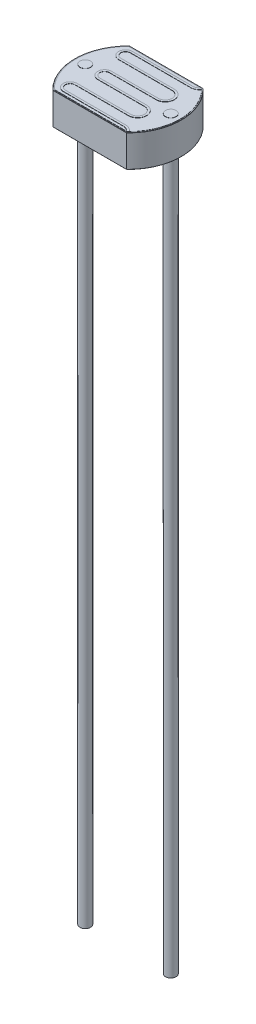
from build123d import *
from build123d.topology import SkipClean

# Parameters (mm, degrees)
BOSS_EXTRUDE1_DEPTH      = 1.5
BOSS_EXTRUDE2_DEPTH      = 0.01
BOSS_EXTRUDE3_DEPTH      = 0.01
BOSS_EXTRUDE4_DEPTH      = 0.01
BOSS_EXTRUDE4_DEPTH_BACK = 35
SKETCH4_R                = 0.25
FILLET1_R                = 0.01


with BuildPart() as part:
    # Sketch1 → Boss-Extrude1 (new body)
    with BuildSketch(Plane(origin=(0, 0, 0), x_dir=(1, 0, 0), z_dir=(0, 1, 0))):
        with BuildLine():
            Line((-1.734935157, 1.8), (1.734935157, 1.8))
            ThreePointArc((1.734935157, 1.8), (2.5, 0), (1.734935157, -1.8))
            Line((1.734935157, -1.8), (-1.734935157, -1.8))
            ThreePointArc((-1.734935157, -1.8), (-2.5, 0), (-1.734935157, 1.8))
        make_face()
    extrude(amount=BOSS_EXTRUDE1_DEPTH)

    # Sketch2 → Boss-Extrude2 (add)
    with BuildSketch(Plane(origin=(0, 1.5, 0), x_dir=(1, 0, 0), z_dir=(0, 1, 0))):
        with BuildLine():
            Line((-1.71464282, -1.75), (1.71464282, -1.75))
            ThreePointArc((1.71464282, -1.75), (2.45, 0), (1.71464282, 1.75))
            Line((1.71464282, 1.75), (-1.71464282, 1.75))
            ThreePointArc((-1.71464282, 1.75), (-2.45, 0), (-1.71464282, -1.75))
        make_face()
    extrude(amount=BOSS_EXTRUDE2_DEPTH)

    # Sketch3 → Boss-Extrude3 (add)
    with SkipClean():  # the faces are left unmerged after this step: merging them gives an invalid solid
        with BuildSketch(Plane(origin=(0, 1.51, 0), x_dir=(1, 0, 0), z_dir=(0, 1, 0))):
            with BuildLine():
                Line((-1.100223992, 0.325), (1.100223992, 0.325))
                ThreePointArc((1.100223992, 0.325), (1.425223992, 0.65), (1.100223992, 0.975))
                Line((1.100223992, 0.975), (-1.100223992, 0.975))
                Line((-1.100223992, 0.975), (-1.415621536, 0.975))
                ThreePointArc((-1.415621536, 0.975), (-1.740621536, 1.3), (-1.415621536, 1.625))
                Line((-1.415621536, 1.625), (1.100223992, 1.625))
                Line((1.100223992, 1.625), (1.414873992, 1.625))
                ThreePointArc((1.414873992, 1.625), (1.55739592, 1.657916964), (1.671047761, 1.75))
                Line((1.671047761, 1.75), (1.71464282, 1.75))
                ThreePointArc((1.71464282, 1.75), (1.737970537, 1.726834796), (1.760985316, 1.703358658))
                ThreePointArc((1.760985316, 1.703358658), (1.609556335, 1.572211984), (1.414873992, 1.525))
                Line((1.414873992, 1.525), (1.100223992, 1.525))
                Line((1.100223992, 1.525), (-1.415621536, 1.525))
                ThreePointArc((-1.415621536, 1.525), (-1.640621536, 1.3), (-1.415621536, 1.075))
                Line((-1.415621536, 1.075), (-1.100223992, 1.075))
                Line((-1.100223992, 1.075), (1.100223992, 1.075))
                ThreePointArc((1.100223992, 1.075), (1.525223992, 0.65), (1.100223992, 0.225))
                Line((1.100223992, 0.225), (-1.100223992, 0.225))
                ThreePointArc((-1.100223992, 0.225), (-1.325223992, 0), (-1.100223992, -0.225))
                Line((-1.100223992, -0.225), (1.100223992, -0.225))
                ThreePointArc((1.100223992, -0.225), (1.525223992, -0.65), (1.100223992, -1.075))
                Line((1.100223992, -1.075), (-1.100223992, -1.075))
                Line((-1.100223992, -1.075), (-1.415621536, -1.075))
                ThreePointArc((-1.415621536, -1.075), (-1.640621536, -1.3), (-1.415621536, -1.525))
                Line((-1.415621536, -1.525), (1.100223992, -1.525))
                Line((1.100223992, -1.525), (1.414873992, -1.525))
                ThreePointArc((1.414873992, -1.525), (1.609556335, -1.572211984), (1.760985316, -1.703358658))
                ThreePointArc((1.760985316, -1.703358658), (1.737970537, -1.726834796), (1.71464282, -1.75))
                Line((1.71464282, -1.75), (1.671047761, -1.75))
                ThreePointArc((1.671047761, -1.75), (1.55739592, -1.657916964), (1.414873992, -1.625))
                Line((1.414873992, -1.625), (1.100223992, -1.625))
                Line((1.100223992, -1.625), (-1.415621536, -1.625))
                ThreePointArc((-1.415621536, -1.625), (-1.740621536, -1.3), (-1.415621536, -0.975))
                Line((-1.415621536, -0.975), (-1.100223992, -0.975))
                Line((-1.100223992, -0.975), (1.100223992, -0.975))
                ThreePointArc((1.100223992, -0.975), (1.425223992, -0.65), (1.100223992, -0.325))
                Line((1.100223992, -0.325), (-1.100223992, -0.325))
                ThreePointArc((-1.100223992, -0.325), (-1.425223992, 0), (-1.100223992, 0.325))
            make_face()
        extrude(amount=BOSS_EXTRUDE3_DEPTH)

    # Sketch4 → Boss-Extrude4 (add, two sides: drawn at the far end of the back side and taken through both)
    with SkipClean():  # the faces are left unmerged after this step: merging them gives an invalid solid
        with BuildSketch(Plane(origin=(0, 1.51, 0), x_dir=(1, 0, 0), z_dir=(0, 1, 0)).offset(-BOSS_EXTRUDE4_DEPTH_BACK)):
            with Locations((-2.009742492, 0)):
                Circle(SKETCH4_R)
            with Locations((2.009742492, 0)):
                Circle(SKETCH4_R)
        extrude(amount=BOSS_EXTRUDE4_DEPTH + BOSS_EXTRUDE4_DEPTH_BACK)

    # Fillet1
    fillet1_edges = [part.edges().sort_by_distance(p)[0] for p in [
        (1.734935157, 0.75, -1.8),
        (0, 1.5, -1.8),
        (0, 0, -1.8),
        (2.5, 0, 0),
        (2.5, 1.5, 0),
        (1.734935157, 0.75, 1.8),
        (0, 0, 1.8),
        (0, 1.5, 1.8),
        (-1.734935157, 0.75, 1.8),
        (-2.5, 0, 0),
        (-2.5, 1.5, 0),
    ]]
    fillet(fillet1_edges, radius=FILLET1_R)


solid = part.part
